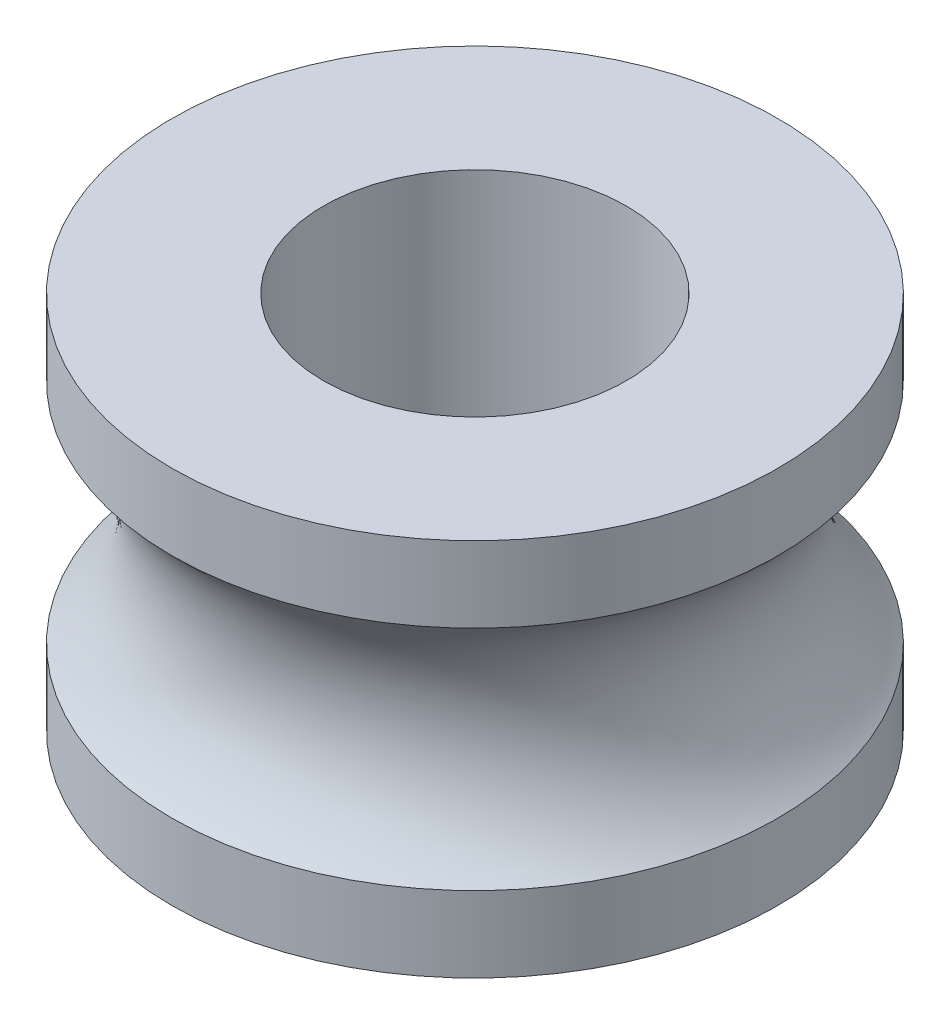
from build123d import *


with BuildPart() as part:
    # 草图1 → 旋转1 (revolve)
    with BuildSketch(Plane.XY, mode=Mode.PRIVATE) as revolve_1_sk:
        with BuildLine():
            Line((2, -2.5), (2, 2.5))
            Line((2, 2.5), (4, 2.5))
            Line((4, 2.5), (4, 1.5))
            ThreePointArc((4, 1.5), (3.322875656, 0), (4, -1.5))
            Line((4, -1.5), (4, -2.5))
            Line((4, -2.5), (2, -2.5))
        make_face()
    revolve(revolve_1_sk.sketch.rotate(Axis((0, 2, 0), (0, -1, 0)), 90), axis=Axis((0, 2, 0), (0, -1, 0)))


solid = part.part
